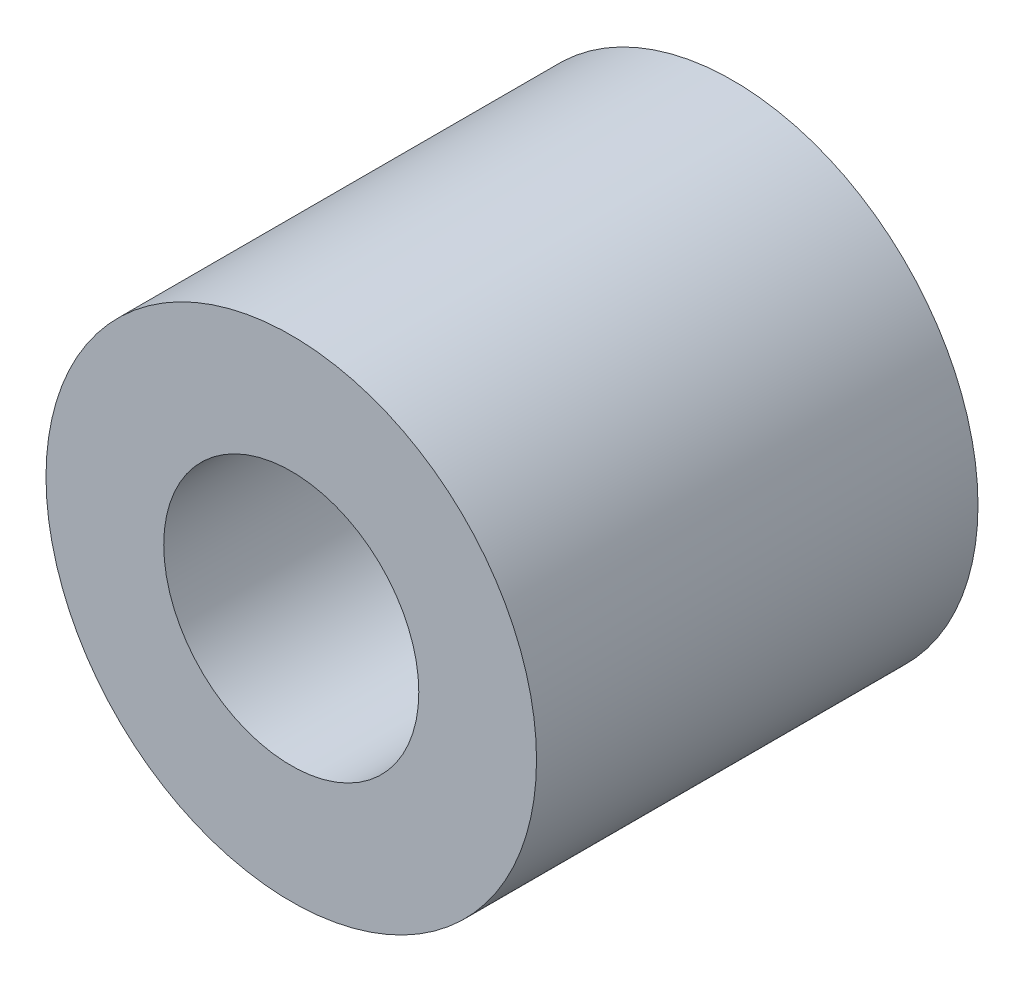
from build123d import *

# Parameters (mm, degrees)
SKETCH1_R           = 6.35
SKETCH1_R_2         = 3.302
BOSS_EXTRUDE1_DEPTH = 11.43


with BuildPart() as part:
    # Sketch1 → Boss-Extrude1 (new body)
    with BuildSketch(Plane.XY):
        Circle(SKETCH1_R)
        Circle(SKETCH1_R_2, mode=Mode.SUBTRACT)
    extrude(amount=BOSS_EXTRUDE1_DEPTH)


solid = part.part
